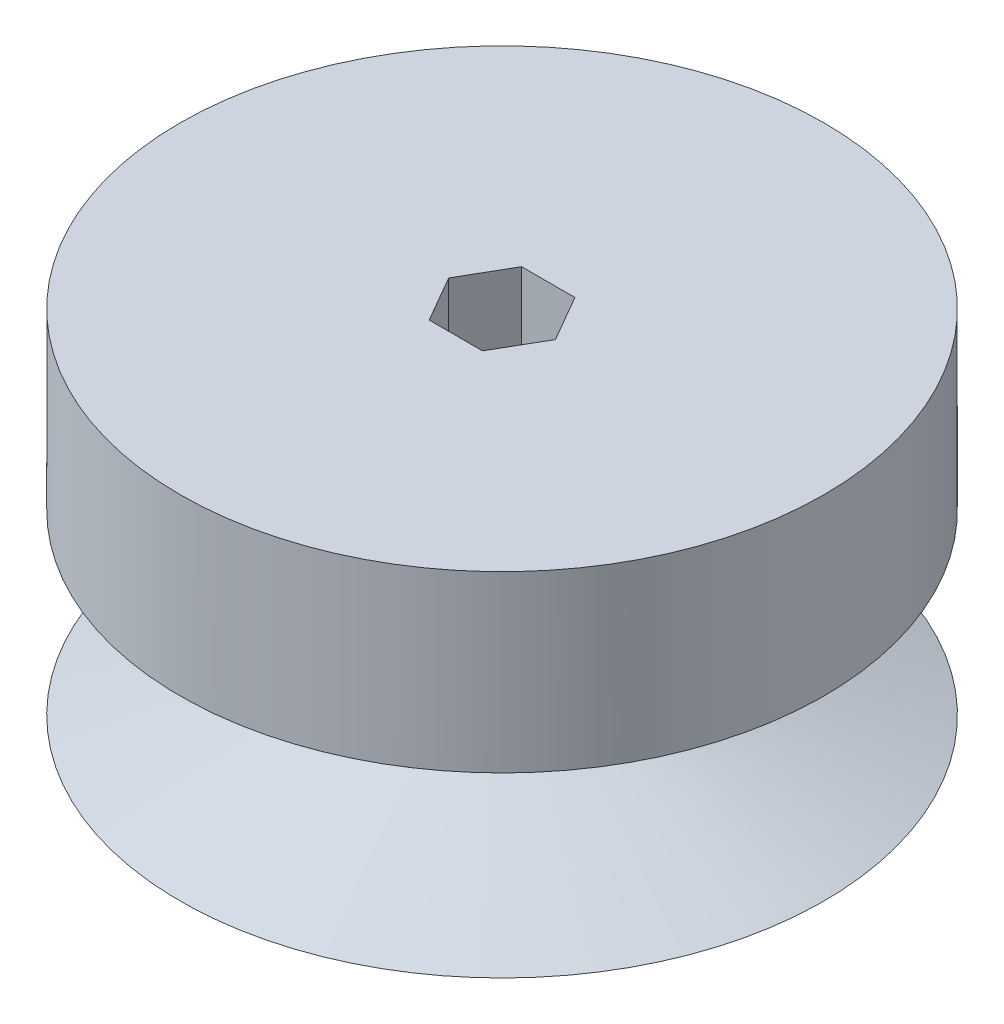
from build123d import *

# Parameters (mm, degrees)
SKETCH2_R           = 12
SKETCH1_R           = 44.25
SKETCH6_R           = 44.25
BOSS_EXTRUDE1_DEPTH = 23.956000094
CUT_EXTRUDE1_DEPTH  = 80.08494037


with BuildPart() as part:
    # Sketch2 → Loft1 section 0
    with BuildSketch(Plane(origin=(0, 12, 0), x_dir=(1, 0, 0), z_dir=(0, 1, 0))):
        Circle(SKETCH2_R)
    # Sketch1 → Loft1 section 1
    with BuildSketch(Plane(origin=(0, 0, 0), x_dir=(1, 0, 0), z_dir=(0, 1, 0))):
        Circle(SKETCH1_R)
    loft()


with BuildPart() as body_2:
    # Mirror2: mirrored copy
    add(part.part.mirror(Plane.ZX.offset(12.200000108)))

    # Sketch6 → Boss-Extrude1 (add)
    with BuildSketch(Plane(origin=(0, 24.400000216, 0), x_dir=(1, 0, 0), z_dir=(0, 1, 0))):
        with Locations(Location((0, 0, 0), (0, 0, 90))):
            Circle(SKETCH6_R)
    extrude(amount=BOSS_EXTRUDE1_DEPTH)


with BuildPart() as cut_extrude1_tool:
    # Sketch7 → Cut-Extrude1 (new, through all)
    with BuildSketch(Plane(origin=(0, 48.35600031, 0), x_dir=(1, 0, 0), z_dir=(0, 1, 0))):
        Polygon((7.332348419, 0), (3.666174209, 6.35), (-3.666174209, 6.35), (-7.332348419, 0), (-3.666174209, -6.35), (3.666174209, -6.35), align=None)
    extrude(amount=-CUT_EXTRUDE1_DEPTH)


with BuildPart() as part_1:
    add(part.part)

    # Cut-Extrude1: cut by cut_extrude1_tool
    add(cut_extrude1_tool.part, mode=Mode.SUBTRACT)


with BuildPart() as body_2_1:
    add(body_2.part)

    # Cut-Extrude1: cut by cut_extrude1_tool
    add(cut_extrude1_tool.part, mode=Mode.SUBTRACT)


solid = Compound([part_1.part, body_2_1.part])
